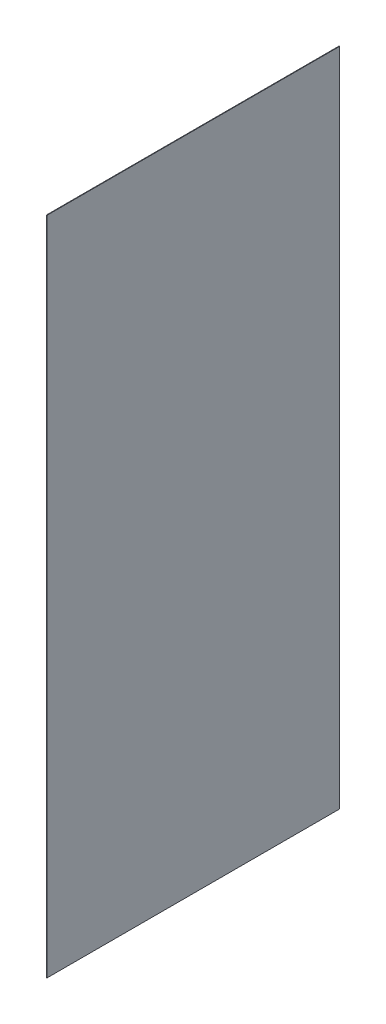
from build123d import *

# Parameters (mm, degrees)
SKETCH1_W                = 1.5
SKETCH1_H                = 1850
PACK_DIS_YAN_SAG_1_DEPTH = 820


with BuildPart() as part:
    # Sketch1 → PACK_dis_yan_sag_1 (new body)
    with BuildSketch(Plane.XY):
        with Locations((699.25, 1045)):
            Rectangle(SKETCH1_W, SKETCH1_H)
    extrude(amount=-PACK_DIS_YAN_SAG_1_DEPTH)


solid = part.part
